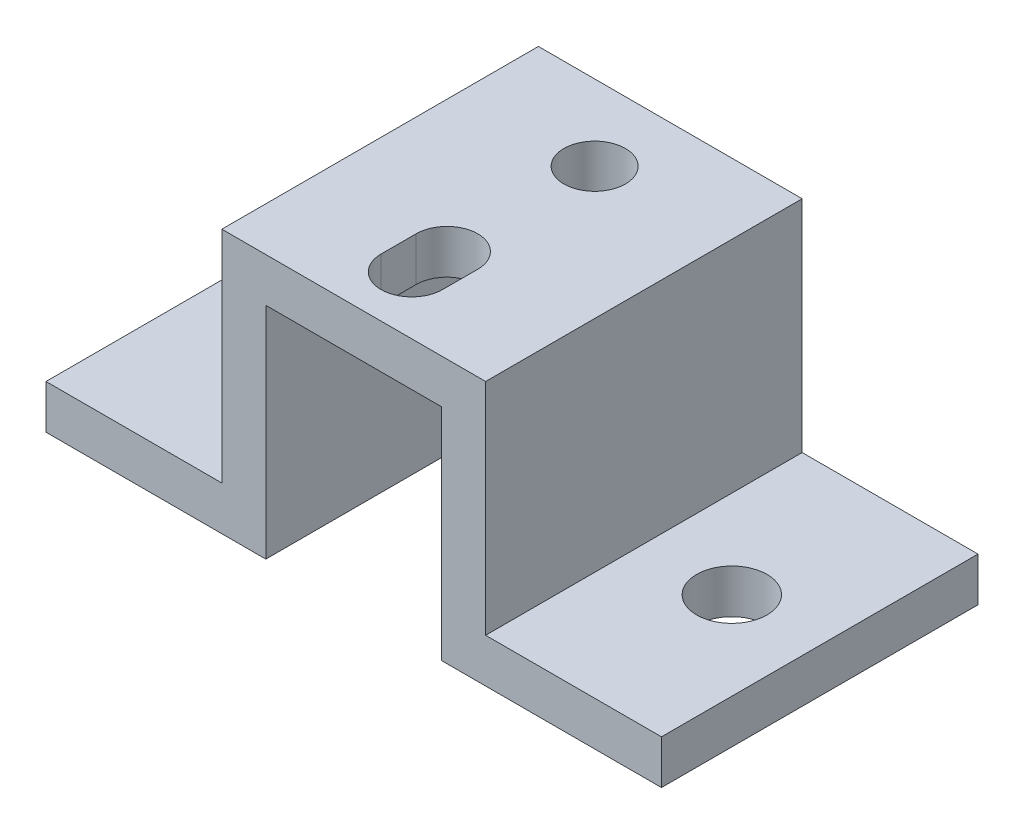
from build123d import *

# Parameters (mm, degrees)
RESSALTO_EXTRUS_O1_DEPTH = 18
ESBO_O2_R                = 1.75
ESBO_O2_R_2              = 2
CORTE_EXTRUS_O1_DEPTH    = 43.118879377


with BuildPart() as part:
    # Esboço1 → Ressalto-extrusão1 (new body)
    with BuildSketch(Plane.XY):
        Polygon((-35, 0), (-25, 0), (-25, 12.5), (-10, 12.5), (-10, 0), (0, 0), (0, -2.5), (-12.5, -2.5), (-12.5, 10), (-22.5, 10), (-22.5, -2.5), (-35, -2.5), align=None)
    extrude(amount=RESSALTO_EXTRUS_O1_DEPTH)

    # Esboço2 → Corte-extrusão1 (cut, through all)
    with BuildSketch(Plane(origin=(0, 12.5, 0), x_dir=(1, 0, 0), z_dir=(0, 1, 0))):
        with Locations(Location((-17.5, -4.3, 0), (0, 0, 270))):
            Circle(ESBO_O2_R)
        with Locations(Location((-30, -9, 0), (0, 0, 270))):
            Circle(ESBO_O2_R_2)
        with Locations(Location((-5, -9, 0), (0, 0, 90))):
            Circle(ESBO_O2_R_2)
        with BuildLine():
            Line((-19.25, -14.7), (-19.25, -12.7))
            ThreePointArc((-19.25, -12.7), (-17.5, -10.95), (-15.75, -12.7))
            Line((-15.75, -12.7), (-15.75, -14.7))
            ThreePointArc((-15.75, -14.7), (-17.5, -16.45), (-19.25, -14.7))
        make_face()
    extrude(amount=-CORTE_EXTRUS_O1_DEPTH, mode=Mode.SUBTRACT)


solid = part.part
